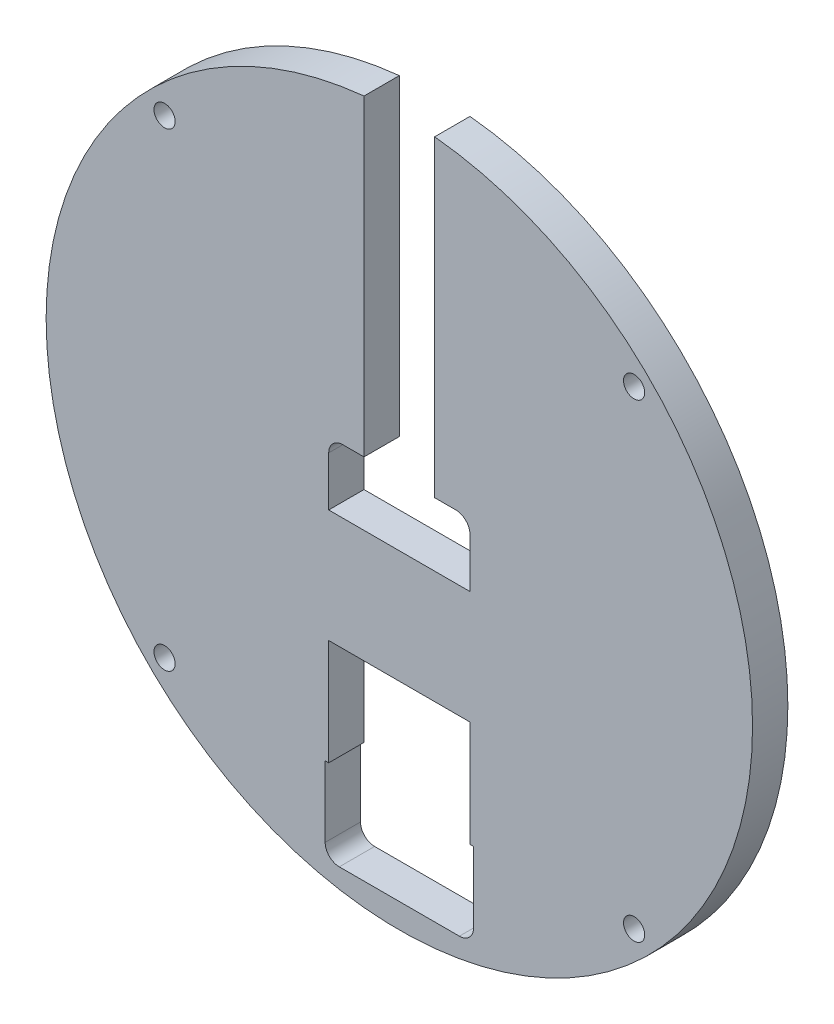
from build123d import *

# Parameters (mm, degrees)
SKETCH_1_R      = 1.5
EXTRUDE_1_DEPTH = 5


with BuildPart() as part:
    # 草图1 → 凸台-拉伸1 (new body)
    with BuildSketch(Plane.XY):
        with BuildLine():
            Line((-5, 5.5), (-5, 49.749371855))
            ThreePointArc((-5, 49.749371855), (-33.541019662, -37.080992435), (50, 0))
            ThreePointArc((50, 0), (37.080992435, 33.541019662), (5, 49.749371855))
            Line((5, 49.749371855), (5, 5.5))
            Line((5, 5.5), (8, 5.5))
            ThreePointArc((8, 5.5), (9.414213562, 4.914213562), (10, 3.5))
            Line((10, 3.5), (10, -3.5))
            Line((10, -3.5), (-10, -3.5))
            Line((-10, -3.5), (-10, 3.5))
            ThreePointArc((-10, 3.5), (-9.414213562, 4.914213562), (-8, 5.5))
            Line((-8, 5.5), (-5, 5.5))
        make_face()
        with Locations((-33.234018716, -33.234018716)):
            Circle(SKETCH_1_R, mode=Mode.SUBTRACT)
        with BuildLine():
            Line((-10.5, -34.5), (-10, -34.5))
            Line((-10, -34.5), (-10, -19.5))
            Line((-10, -19.5), (10, -19.5))
            Line((10, -19.5), (10, -34.5))
            Line((10, -34.5), (10.5, -34.5))
            Line((10.5, -34.5), (10.5, -44.5))
            ThreePointArc((10.5, -44.5), (9.914213562, -45.914213562), (8.5, -46.5))
            Line((8.5, -46.5), (-8.5, -46.5))
            ThreePointArc((-8.5, -46.5), (-9.914213562, -45.914213562), (-10.5, -44.5))
            Line((-10.5, -44.5), (-10.5, -34.5))
        make_face(mode=Mode.SUBTRACT)
        with Locations((33.234018716, -33.234018716)):
            Circle(SKETCH_1_R, mode=Mode.SUBTRACT)
        with Locations((-33.234018716, 33.234018716)):
            Circle(SKETCH_1_R, mode=Mode.SUBTRACT)
        with Locations((33.234018716, 33.234018716)):
            Circle(SKETCH_1_R, mode=Mode.SUBTRACT)
    extrude(amount=EXTRUDE_1_DEPTH)


solid = part.part
